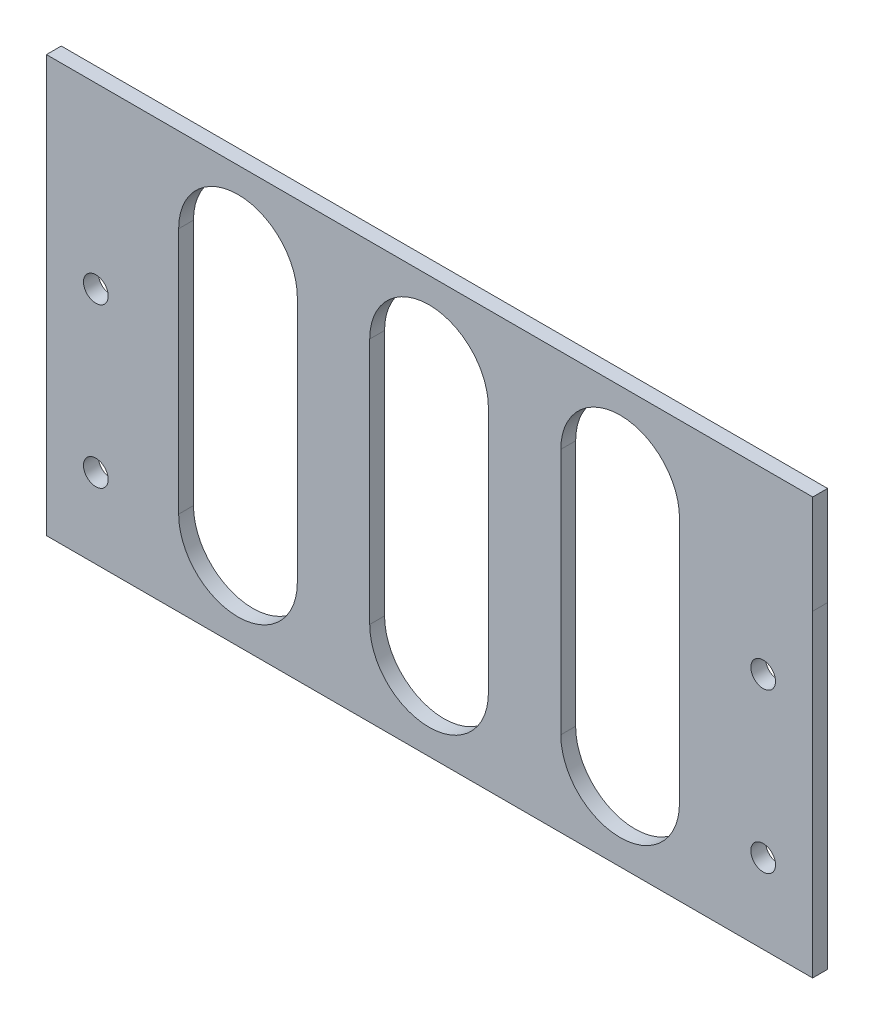
from build123d import *

# Parameters (mm, degrees)
ESQUISSE2_W             = 154.98
ESQUISSE2_H             = 3
BOSS_EXTRU_1_DEPTH      = 64.27
ESQUISSE3_R             = 2.5
ENL_V_MAT_EXTRU_1_DEPTH = 102.054178938
ENL_V_MAT_EXTRU_2_DEPTH = 102.054178938
SKETCH1_W               = 155.004364221
SKETCH1_H               = 20
BOSS_EXTRUDE1_DEPTH     = 3
CUT_EXTRUDE1_DEPTH      = 10


with BuildPart() as part:
    # Esquisse2 → Boss.-Extru.1 (new body)
    with BuildSketch(Plane(origin=(0, 0, 0), x_dir=(1, 0, 0), z_dir=(0, 1, 0))):
        with Locations((-0.435054897, 0)):
            Rectangle(ESQUISSE2_W, ESQUISSE2_H)
    extrude(amount=BOSS_EXTRU_1_DEPTH)

    # Esquisse3 → Enlèv. mat.-Extru.1 (cut, through all)
    with BuildSketch(Plane.XY.offset(1.5)):
        with Locations((-67.925054897, 16.0675)):
            Circle(ESQUISSE3_R)
        with Locations((-67.925054897, 48.2025)):
            Circle(ESQUISSE3_R)
        with Locations((67.054945103, 48.2025)):
            Circle(ESQUISSE3_R)
        with Locations((67.054945103, 16.0675)):
            Circle(ESQUISSE3_R)
    extrude(amount=-ENL_V_MAT_EXTRU_1_DEPTH, mode=Mode.SUBTRACT)

    # Esquisse4 → Enlèv. mat.-Extru.2 (cut, through all)
    with BuildSketch(Plane.XY.offset(1.5)):
        with BuildLine():
            Line((-41.680054897, 47.135), (-41.680054897, 17.135))
            ThreePointArc((-41.680054897, 17.135), (-39.180054897, 14.635), (-36.680054897, 17.135))
            Line((-36.680054897, 17.135), (-36.680054897, 47.135))
            ThreePointArc((-36.680054897, 47.135), (-39.180054897, 49.635), (-41.680054897, 47.135))
        make_face()
        with BuildLine():
            Line((-2.935054897, 47.135), (-2.935054897, 17.135))
            ThreePointArc((-2.935054897, 17.135), (-0.435054897, 14.635), (2.064945103, 17.135))
            Line((2.064945103, 17.135), (2.064945103, 47.135))
            ThreePointArc((2.064945103, 47.135), (-0.435054897, 49.635), (-2.935054897, 47.135))
        make_face()
        with BuildLine():
            Line((35.809945103, 47.135), (35.809945103, 17.135))
            ThreePointArc((35.809945103, 17.135), (38.309945103, 14.635), (40.809945103, 17.135))
            Line((40.809945103, 17.135), (40.809945103, 47.135))
            ThreePointArc((40.809945103, 47.135), (38.309945103, 49.635), (35.809945103, 47.135))
        make_face()
    extrude(amount=-ENL_V_MAT_EXTRU_2_DEPTH, mode=Mode.SUBTRACT)

    # Sketch1 → Boss-Extrude1 (add)
    with BuildSketch(Plane.XY.offset(1.5)):
        with Locations((-0.422872787, 74.27)):
            Rectangle(SKETCH1_W, SKETCH1_H)
    extrude(amount=-BOSS_EXTRUDE1_DEPTH)

    # Sketch2 → Cut-Extrude1 (cut)
    with BuildSketch(Plane.XY.offset(1.5)):
        with BuildLine():
            Line((-27.180054897, 67.135), (-27.180054897, 17.135))
            ThreePointArc((-27.180054897, 17.135), (-39.180054897, 5.135), (-51.180054897, 17.135))
            Line((-51.180054897, 17.135), (-51.180054897, 67.135))
            ThreePointArc((-51.180054897, 67.135), (-39.180054897, 79.135), (-27.180054897, 67.135))
        make_face()
        with BuildLine():
            Line((-12.530054897, 67.135), (-12.530054897, 17.135))
            ThreePointArc((-12.530054897, 17.135), (-0.530054897, 5.135), (11.469945103, 17.135))
            Line((11.469945103, 17.135), (11.469945103, 67.135))
            ThreePointArc((11.469945103, 67.135), (-0.530054897, 79.135), (-12.530054897, 67.135))
        make_face()
        with BuildLine():
            Line((26.119945103, 67.135), (26.119945103, 17.135))
            ThreePointArc((26.119945103, 17.135), (38.119945103, 5.135), (50.119945103, 17.135))
            Line((50.119945103, 17.135), (50.119945103, 67.135))
            ThreePointArc((50.119945103, 67.135), (38.119945103, 79.135), (26.119945103, 67.135))
        make_face()
    extrude(amount=-CUT_EXTRUDE1_DEPTH, mode=Mode.SUBTRACT)


solid = part.part
